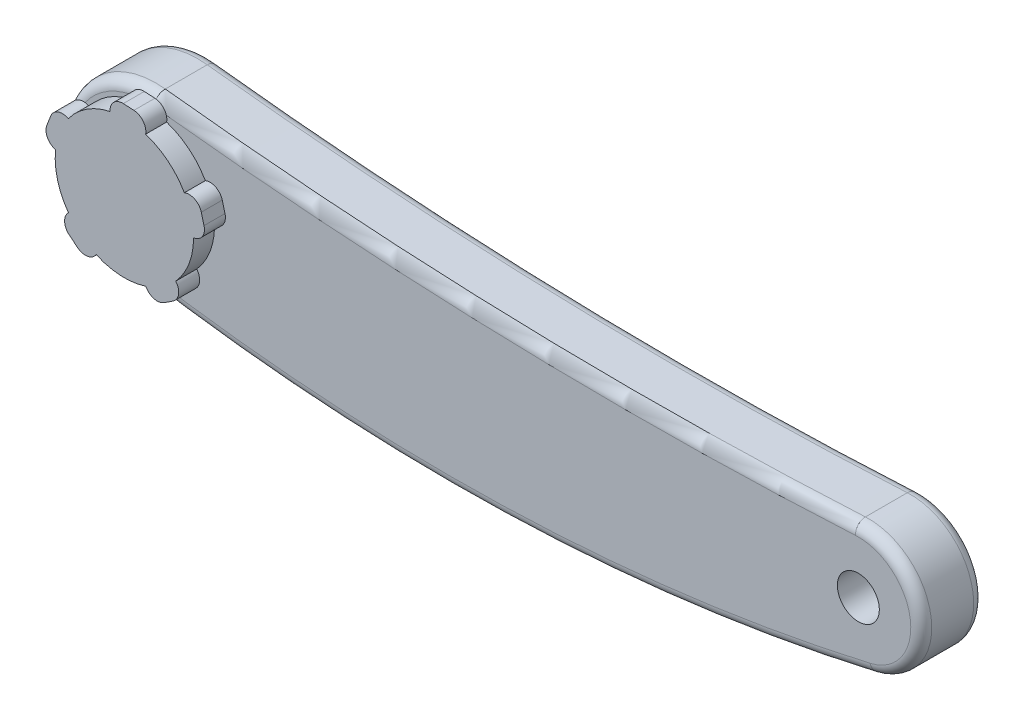
from build123d import *

# Parameters (mm, degrees)
BOSS_EXTRUDE1_DEPTH = 7.5
FILLET1_R           = 2.5
SKETCH3_R           = 16.5
BOSS_EXTRUDE2_DEPTH = 5
BOSS_EXTRUDE3_START = -5
BOSS_EXTRUDE3_DEPTH = 5
SKETCH5_R           = 5
BOSS_EXTRUDE4_DEPTH = 10
SKETCH6_R           = 5
CUT_EXTRUDE1_DEPTH  = 10


with BuildPart() as part:
    # Sketch2 → Boss-Extrude1 (new, symmetric)
    with BuildSketch(Plane.XY):
        with BuildLine():
            ThreePointArc((102.783087905, 14.977902914), (19.214406157, 13.934366249), (-64.149557364, 19.872642429))
            ThreePointArc((-64.149557364, 19.872642429), (-86.204808933, 2.808746854), (-69.764850677, -19.715427415))
            ThreePointArc((-69.764850677, -19.715427415), (18.853783166, -25.931146508), (106.966657885, -14.61660998))
            ThreePointArc((106.966657885, -14.61660998), (118.44931566, 2.099570811), (102.783087905, 14.977902914))
        make_face()
    extrude(amount=BOSS_EXTRUDE1_DEPTH, both=True)

    # Fillet1
    fillet1_edges = [part.edges().sort_by_distance(p)[0] for p in [
        (18.853783166, -25.931146508, -7.5),
        (118.44931566, 2.099570811, -7.5),
        (118.44931566, 2.099570811, 7.5),
        (-86.204808933, 2.808746854, -7.5),
        (-86.204808933, 2.808746854, 7.5),
        (19.214406157, 13.934366249, -7.5),
        (19.214406157, 13.934366249, 7.5),
        (18.853783166, -25.931146508, 7.5),
    ]]
    fillet(fillet1_edges, radius=FILLET1_R)

    # Sketch3 → Boss-Extrude2 (add)
    with BuildSketch(Plane.XY.offset(7.5)):
        with Locations((-66.403017571, 0)):
            Circle(SKETCH3_R)
    extrude(amount=BOSS_EXTRUDE2_DEPTH)

    # Sketch4 → Boss-Extrude3 (add)
    with BuildSketch(Plane.XY.offset(12.5).offset(BOSS_EXTRUDE3_START)):
        with BuildLine():
            ThreePointArc((-52.099568751, 8.225652062), (-50.465241438, 4.270514244), (-49.9030415, 0.028100762))
            ThreePointArc((-49.9030415, 0.028100762), (-47.813230422, 1.340878735), (-47.414916211, 3.776457135))
            Line((-47.414916211, 3.776457135), (-48.070610856, 6.223542865))
            ThreePointArc((-48.070610856, 6.223542865), (-49.633350281, 8.133658527), (-52.099568751, 8.225652062))
        make_face()
        with BuildLine():
            ThreePointArc((-54.819051353, -15.511974356), (-53.485336446, -13.435462641), (-54.159948813, -11.061521929))
            ThreePointArc((-54.159948813, -11.061521929), (-57.416473494, -13.838064371), (-61.277519146, -15.683726148))
            ThreePointArc((-61.277519146, -15.683726148), (-59.383205961, -17.265583889), (-56.943747393, -16.891768097))
            Line((-56.943747393, -16.891768097), (-54.819051353, -15.511974356))
        make_face()
        with BuildLine():
            ThreePointArc((-77.576139439, -15.810470249), (-75.18911887, -16.437231094), (-73.139833772, -15.062048582))
            ThreePointArc((-73.139833772, -15.062048582), (-76.786804024, -12.822908364), (-79.735261406, -9.721176591))
            ThreePointArc((-79.735261406, -9.721176591), (-80.654322552, -12.011596414), (-79.544968453, -14.21614395))
            Line((-79.544968453, -14.21614395), (-77.576139439, -15.810470249))
        make_face()
        with BuildLine():
            ThreePointArc((-84.892352865, 5.740566364), (-84.750807928, 3.276695145), (-82.809667718, 1.752663965))
            ThreePointArc((-82.809667718, 1.752663965), (-81.807094609, 5.913071167), (-79.768295833, 9.675708604))
            ThreePointArc((-79.768295833, 9.675708604), (-82.230620043, 9.842009046), (-83.984460073, 8.105707948))
            Line((-83.984460073, 8.105707948), (-84.892352865, 5.740566364))
        make_face()
        with BuildLine():
            ThreePointArc((-66.656933344, 19.358335376), (-68.956474332, 18.462340064), (-69.806068802, 16.145254483))
            ThreePointArc((-69.806068802, 16.145254483), (-65.539474293, 16.477387323), (-61.330969971, 15.701093374))
            ThreePointArc((-61.330969971, 15.701093374), (-61.933708879, 18.094292522), (-64.126995727, 19.225746964))
            Line((-64.126995727, 19.225746964), (-66.656933344, 19.358335376))
        make_face()
    extrude(amount=BOSS_EXTRUDE3_DEPTH)

    # Sketch5 → Boss-Extrude4 (add)
    with BuildSketch(Plane(origin=(0, 0, -7.5), x_dir=(-1, 0, 0), z_dir=(0, 0, -1))):
        with Locations(Location((66.403017571, 0, 0), (0, 0, 180))):
            Circle(SKETCH5_R)
    extrude(amount=BOSS_EXTRUDE4_DEPTH)

    # Sketch6 → Cut-Extrude1 (cut)
    with BuildSketch(Plane.XY.offset(7.5)):
        with Locations((103.596982429, 0)):
            Circle(SKETCH6_R)
    extrude(amount=-CUT_EXTRUDE1_DEPTH, mode=Mode.SUBTRACT)


solid = part.part
